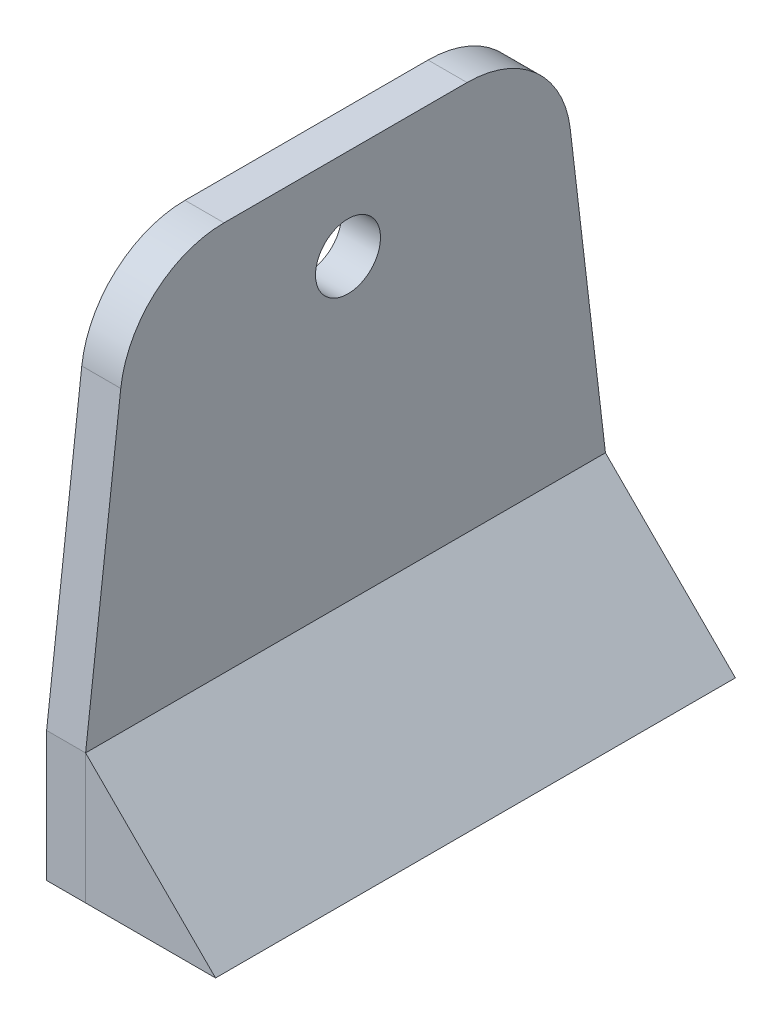
from build123d import *

# Parameters (mm, degrees)
SKETCH2_R           = 2.5
BOSS_EXTRUDE1_DEPTH = 3
BOSS_EXTRUDE2_DEPTH = 20


with BuildPart() as part:
    # Sketch2 → Boss-Extrude1 (new body)
    with BuildSketch(Plane.ZY.offset(18.65)):
        with BuildLine():
            Line((20, 10), (20, 0))
            Line((20, 0), (-20, 0))
            Line((-20, 0), (-20, 10))
            Line((-20, 10), (-17.294825357, 32.937019605))
            ThreePointArc((-17.294825357, 32.937019605), (-14.665143895, 37.978969679), (-9.349890224, 40))
            Line((-9.349890224, 40), (9.349890224, 40))
            ThreePointArc((9.349890224, 40), (14.665143895, 37.978969679), (17.294825357, 32.937019605))
            Line((17.294825357, 32.937019605), (20, 10))
        make_face()
        with Locations((-0.191504709, 33)):
            Circle(SKETCH2_R, mode=Mode.SUBTRACT)
    extrude(amount=BOSS_EXTRUDE1_DEPTH)


with BuildPart() as body_2:
    # Sketch3 → Boss-Extrude2 (new, symmetric)
    with BuildSketch(Plane.XY):
        Polygon((-18.65, 10), (-8.65, 0), (-18.65, 0), align=None)
    extrude(amount=BOSS_EXTRUDE2_DEPTH, both=True)


solid = Compound([part.part, body_2.part])
